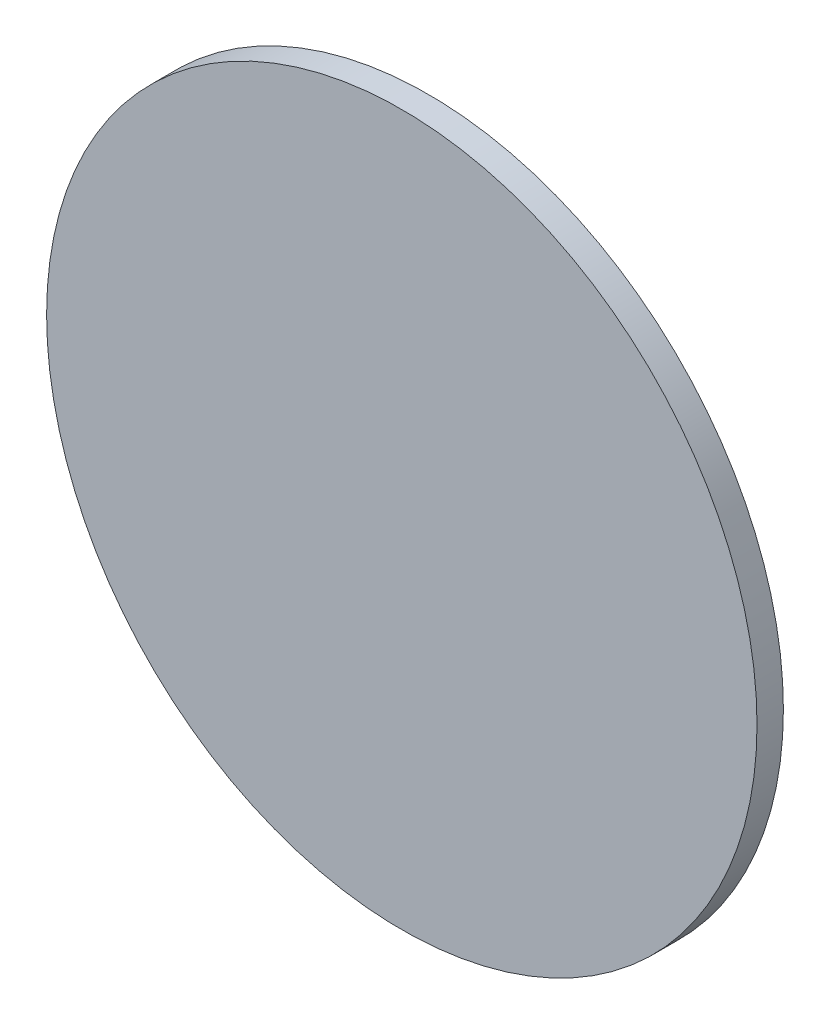
from build123d import *

# Parameters (mm, degrees)
SKETCH_1_R      = 20.2
EXTRUDE_1_DEPTH = 1.5


with BuildPart() as part:
    # 草图1 → 凸台-拉伸1 (new body)
    with BuildSketch(Plane.XY):
        Circle(SKETCH_1_R)
    extrude(amount=EXTRUDE_1_DEPTH)


solid = part.part
